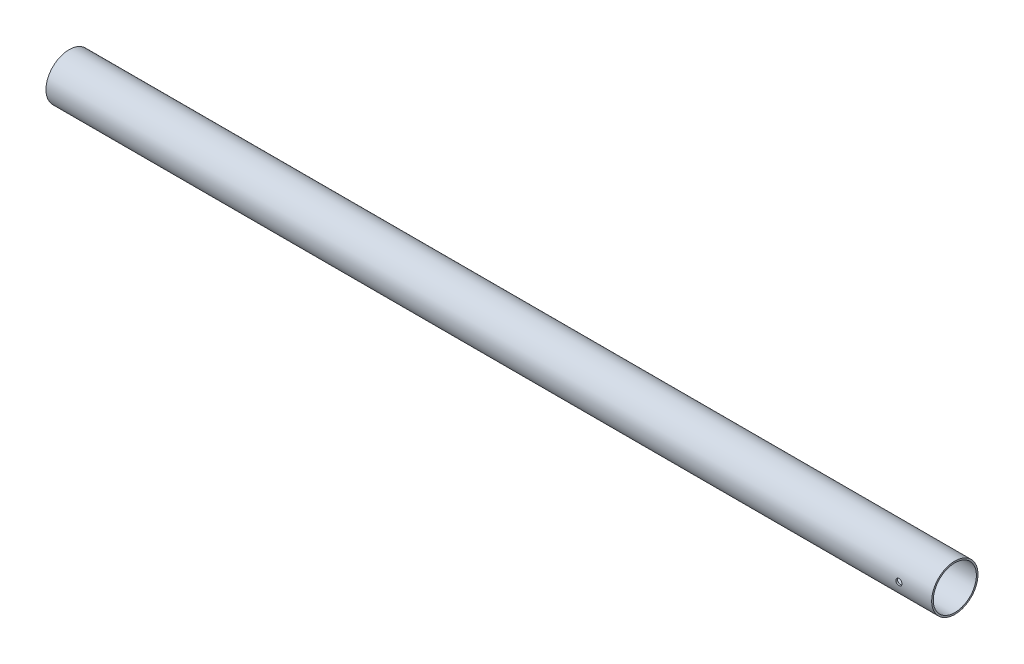
from build123d import *

# Parameters (mm, degrees)
SKETCH1_R               = 12.7
SKETCH1_R_2             = 11.811
BOSS_EXTRUDE1_DEPTH     = 485.9
CUT_EXTRUDE1_DEPTH      = 487.231827424
CUT_EXTRUDE1_DEPTH_BACK = 487.231827424
SKETCH2_R               = 1.7


with BuildPart() as part:
    # Sketch1 → Boss-Extrude1 (new body)
    with BuildSketch(Plane(origin=(0, 0, 0), x_dir=(0, 0, -1), z_dir=(1, 0, 0))):
        Circle(SKETCH1_R)
        Circle(SKETCH1_R_2, mode=Mode.SUBTRACT)
    extrude(amount=BOSS_EXTRUDE1_DEPTH)

    # Sketch2 → Cut-Extrude1 (cut, two sides: drawn at the far end of the back side and taken through both)
    with BuildSketch(Plane.XY.offset(-CUT_EXTRUDE1_DEPTH_BACK)):
        with Locations((467.9, 0)):
            Circle(SKETCH2_R)
    extrude(amount=CUT_EXTRUDE1_DEPTH + CUT_EXTRUDE1_DEPTH_BACK, mode=Mode.SUBTRACT)


solid = part.part
